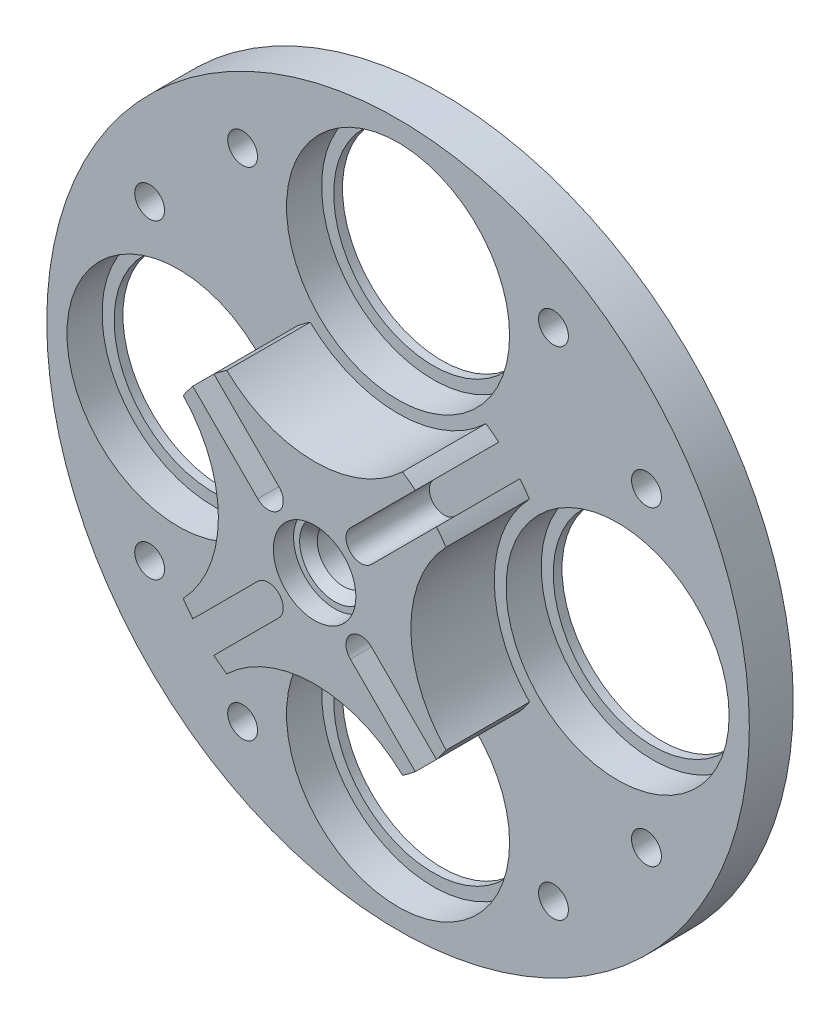
from build123d import *

# Parameters (mm, degrees)
SKETCH2_R           = 40
SKETCH2_R_2         = 11.33
SKETCH2_R_3         = 3
SKETCH2_R_4         = 1.7
BOSS_EXTRUDE1_DEPTH = 1
SKETCH3_R           = 40
SKETCH3_R_2         = 12.7
SKETCH3_R_3         = 3
SKETCH3_R_4         = 1.7
BOSS_EXTRUDE2_DEPTH = 4
SKETCH4_R           = 3
BOSS_EXTRUDE3_DEPTH = 9.5
SKETCH6_R           = 4.7
CUT_EXTRUDE2_DEPTH  = 2.3
CHAMFER1_SIZE       = 1
CUT_EXTRUDE1_DEPTH  = 2.1


with BuildPart() as part:
    # Sketch2 → Boss-Extrude1 (new body)
    with BuildSketch(Plane.XY):
        Circle(SKETCH2_R)
        with Locations((0, 25)):
            Circle(SKETCH2_R_2, mode=Mode.SUBTRACT)
        with Locations((25, 0)):
            Circle(SKETCH2_R_2, mode=Mode.SUBTRACT)
        with Locations((0, -25)):
            Circle(SKETCH2_R_2, mode=Mode.SUBTRACT)
        with Locations((-25, 0)):
            Circle(SKETCH2_R_2, mode=Mode.SUBTRACT)
        Circle(SKETCH2_R_3, mode=Mode.SUBTRACT)
        with Locations((17.697840613, 28.284271247)):
            Circle(SKETCH2_R_4, mode=Mode.SUBTRACT)
        with Locations((-17.697840613, 28.284271247)):
            Circle(SKETCH2_R_4, mode=Mode.SUBTRACT)
        with Locations((28.284271247, -17.697840613)):
            Circle(SKETCH2_R_4, mode=Mode.SUBTRACT)
        with Locations((28.284271247, 17.697840613)):
            Circle(SKETCH2_R_4, mode=Mode.SUBTRACT)
        with Locations((-17.697840613, -28.284271247)):
            Circle(SKETCH2_R_4, mode=Mode.SUBTRACT)
        with Locations((17.697840613, -28.284271247)):
            Circle(SKETCH2_R_4, mode=Mode.SUBTRACT)
        with Locations((-28.284271247, 17.697840613)):
            Circle(SKETCH2_R_4, mode=Mode.SUBTRACT)
        with Locations((-28.284271247, -17.697840613)):
            Circle(SKETCH2_R_4, mode=Mode.SUBTRACT)
    extrude(amount=BOSS_EXTRUDE1_DEPTH)

    # Sketch3 → Boss-Extrude2 (add)
    with BuildSketch(Plane.XY.offset(1)):
        Circle(SKETCH3_R)
        with Locations((0, 25)):
            Circle(SKETCH3_R_2, mode=Mode.SUBTRACT)
        with Locations((25, 0)):
            Circle(SKETCH3_R_2, mode=Mode.SUBTRACT)
        with Locations((0, -25)):
            Circle(SKETCH3_R_2, mode=Mode.SUBTRACT)
        with Locations((-25, 0)):
            Circle(SKETCH3_R_2, mode=Mode.SUBTRACT)
        Circle(SKETCH3_R_3, mode=Mode.SUBTRACT)
        with Locations((17.697840613, 28.284271247)):
            Circle(SKETCH3_R_4, mode=Mode.SUBTRACT)
        with Locations((-17.697840613, 28.284271247)):
            Circle(SKETCH3_R_4, mode=Mode.SUBTRACT)
        with Locations((28.284271247, -17.697840613)):
            Circle(SKETCH3_R_4, mode=Mode.SUBTRACT)
        with Locations((28.284271247, 17.697840613)):
            Circle(SKETCH3_R_4, mode=Mode.SUBTRACT)
        with Locations((-17.697840613, -28.284271247)):
            Circle(SKETCH3_R_4, mode=Mode.SUBTRACT)
        with Locations((17.697840613, -28.284271247)):
            Circle(SKETCH3_R_4, mode=Mode.SUBTRACT)
        with Locations((-28.284271247, 17.697840613)):
            Circle(SKETCH3_R_4, mode=Mode.SUBTRACT)
        with Locations((-28.284271247, -17.697840613)):
            Circle(SKETCH3_R_4, mode=Mode.SUBTRACT)
    extrude(amount=BOSS_EXTRUDE2_DEPTH)

    # Sketch4 → Boss-Extrude3 (add)
    with BuildSketch(Plane.XY.offset(5)):
        with BuildLine():
            Line((11.468948422, 13.873111478), (4.069996411, 6.474159467))
            ThreePointArc((4.069996411, 6.474159467), (4.069996411, 4.069996411), (6.474159467, 4.069996411))
            Line((6.474159467, 4.069996411), (13.873111478, 11.468948422))
            ThreePointArc((13.873111478, 11.468948422), (14.436174385, 10.751598445), (14.962183071, 10.006651675))
            ThreePointArc((14.962183071, 10.006651675), (10.955844123, 0), (14.962183071, -10.006651675))
            ThreePointArc((14.962183071, -10.006651675), (14.436174385, -10.751598445), (13.873111478, -11.468948422))
            Line((13.873111478, -11.468948422), (6.474159467, -4.069996411))
            ThreePointArc((6.474159467, -4.069996411), (4.069996411, -4.069996411), (4.069996411, -6.474159467))
            Line((4.069996411, -6.474159467), (11.468948422, -13.873111478))
            ThreePointArc((11.468948422, -13.873111478), (10.751598445, -14.436174385), (10.006651675, -14.962183071))
            ThreePointArc((10.006651675, -14.962183071), (0, -10.955844123), (-10.006651675, -14.962183071))
            ThreePointArc((-10.006651675, -14.962183071), (-10.751598445, -14.436174385), (-11.468948422, -13.873111478))
            Line((-11.468948422, -13.873111478), (-4.069996411, -6.474159467))
            ThreePointArc((-4.069996411, -6.474159467), (-4.069996411, -4.069996411), (-6.474159467, -4.069996411))
            Line((-6.474159467, -4.069996411), (-13.873111478, -11.468948422))
            ThreePointArc((-13.873111478, -11.468948422), (-14.436174385, -10.751598445), (-14.962183071, -10.006651675))
            ThreePointArc((-14.962183071, -10.006651675), (-10.955844123, 0), (-14.962183071, 10.006651675))
            ThreePointArc((-14.962183071, 10.006651675), (-14.436174385, 10.751598445), (-13.873111478, 11.468948422))
            Line((-13.873111478, 11.468948422), (-6.474159467, 4.069996411))
            ThreePointArc((-6.474159467, 4.069996411), (-4.069996411, 4.069996411), (-4.069996411, 6.474159467))
            Line((-4.069996411, 6.474159467), (-11.468948422, 13.873111478))
            ThreePointArc((-11.468948422, 13.873111478), (-10.751598445, 14.436174385), (-10.006651675, 14.962183071))
            ThreePointArc((-10.006651675, 14.962183071), (0, 10.955844123), (10.006651675, 14.962183071))
            ThreePointArc((10.006651675, 14.962183071), (10.751598445, 14.436174385), (11.468948422, 13.873111478))
        make_face()
        Circle(SKETCH4_R, mode=Mode.SUBTRACT)
    extrude(amount=BOSS_EXTRUDE3_DEPTH)

    # Sketch6 → Cut-Extrude2 (cut)
    with BuildSketch(Plane.XY.offset(14.5)):
        Circle(SKETCH6_R)
    extrude(amount=-CUT_EXTRUDE2_DEPTH, mode=Mode.SUBTRACT)

    # Chamfer1
    chamfer1_edges = [part.edges().sort_by_distance(p)[0] for p in [
        (-3, 0, 12.2),
    ]]
    chamfer(chamfer1_edges, length=CHAMFER1_SIZE)

    # Sketch5 → Cut-Extrude1 (cut)
    with BuildSketch(Plane(origin=(0, 0, 0), x_dir=(-1, 0, 0), z_dir=(0, 0, -1))):
        Polygon((29.929719515, 14.847840613), (31.575167782, 17.697840613), (29.929719515, 20.547840613), (26.63882298, 20.547840613), (24.993374713, 17.697840613), (26.63882298, 14.847840613), align=None)
        Polygon((-14.847840613, 29.929719515), (-17.697840613, 31.575167782), (-20.547840613, 29.929719515), (-20.547840613, 26.63882298), (-17.697840613, 24.993374713), (-14.847840613, 26.63882298), align=None)
        Polygon((20.547840613, 26.63882298), (20.547840613, 29.929719515), (17.697840613, 31.575167782), (14.847840613, 29.929719515), (14.847840613, 26.63882298), (17.697840613, 24.993374713), align=None)
        Polygon((26.63882298, -20.547840613), (29.929719515, -20.547840613), (31.575167782, -17.697840613), (29.929719515, -14.847840613), (26.63882298, -14.847840613), (24.993374713, -17.697840613), align=None)
        Polygon((14.847840613, -29.929719515), (17.697840613, -31.575167782), (20.547840613, -29.929719515), (20.547840613, -26.63882298), (17.697840613, -24.993374713), (14.847840613, -26.63882298), align=None)
        Polygon((-20.547840613, -26.63882298), (-20.547840613, -29.929719515), (-17.697840613, -31.575167782), (-14.847840613, -29.929719515), (-14.847840613, -26.63882298), (-17.697840613, -24.993374713), align=None)
        Polygon((-29.929719515, -14.847840613), (-31.575167782, -17.697840613), (-29.929719515, -20.547840613), (-26.63882298, -20.547840613), (-24.993374713, -17.697840613), (-26.63882298, -14.847840613), align=None)
        Polygon((-26.63882298, 20.547840613), (-29.929719515, 20.547840613), (-31.575167782, 17.697840613), (-29.929719515, 14.847840613), (-26.63882298, 14.847840613), (-24.993374713, 17.697840613), align=None)
    extrude(amount=-CUT_EXTRUDE1_DEPTH, mode=Mode.SUBTRACT)


solid = part.part
